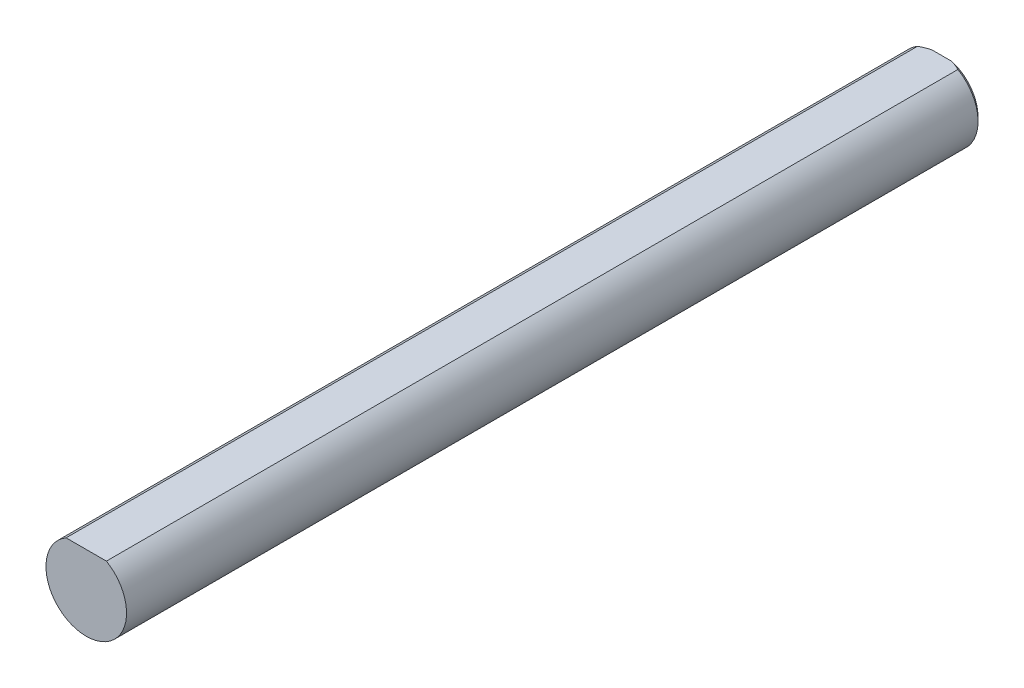
from build123d import *

# Parameters (mm, degrees)
BOSS_EXTRUDE2_DEPTH      = 76.2
BOSS_EXTRUDE2_DEPTH_BACK = 76.2
SKETCH3_R                = 3.175
CUT_EXTRUDE5_DEPTH       = 77.332177029
CUT_EXTRUDE5_DEPTH_BACK  = 77.332177029
CHAMFER1_SIZE            = 0.3175
SKETCH11_W               = 9.577733326
SKETCH11_H               = 8.205515822
CUT_EXTRUDE6_DEPTH       = 85


with BuildPart() as part:
    # Sketch3 → Boss-Extrude2 (new, two sides: drawn at the far end of the back side and taken through both)
    with BuildSketch(Plane.XY.offset(-BOSS_EXTRUDE2_DEPTH_BACK)):
        with Locations(Location((0, 0, 0), (0, 0, 180))):
            Circle(SKETCH3_R)
    extrude(amount=BOSS_EXTRUDE2_DEPTH + BOSS_EXTRUDE2_DEPTH_BACK)

    # Sketch10 → Cut-Extrude5 (cut, two sides: drawn at the far end of the back side and taken through both)
    with BuildSketch(Plane.XY.offset(-CUT_EXTRUDE5_DEPTH_BACK)):
        with BuildLine():
            Line((-1.5875, 2.749630657), (1.5875, 2.749630657))
            ThreePointArc((1.5875, 2.749630657), (0, 3.175), (-1.5875, 2.749630657))
        make_face()
    extrude(amount=CUT_EXTRUDE5_DEPTH + CUT_EXTRUDE5_DEPTH_BACK, mode=Mode.SUBTRACT)

    # Chamfer1
    chamfer1_edges = [part.edges().sort_by_distance(p)[0] for p in [
        (0, -3.175, -76.2),
        (0, -3.175, 76.2),
    ]]
    chamfer(chamfer1_edges, length=CHAMFER1_SIZE)

    # Sketch11 → Cut-Extrude6 (cut)
    with BuildSketch(Plane.XY.offset(76.2)):
        Rectangle(SKETCH11_W, SKETCH11_H)
    extrude(amount=-CUT_EXTRUDE6_DEPTH, mode=Mode.SUBTRACT)


solid = part.part
